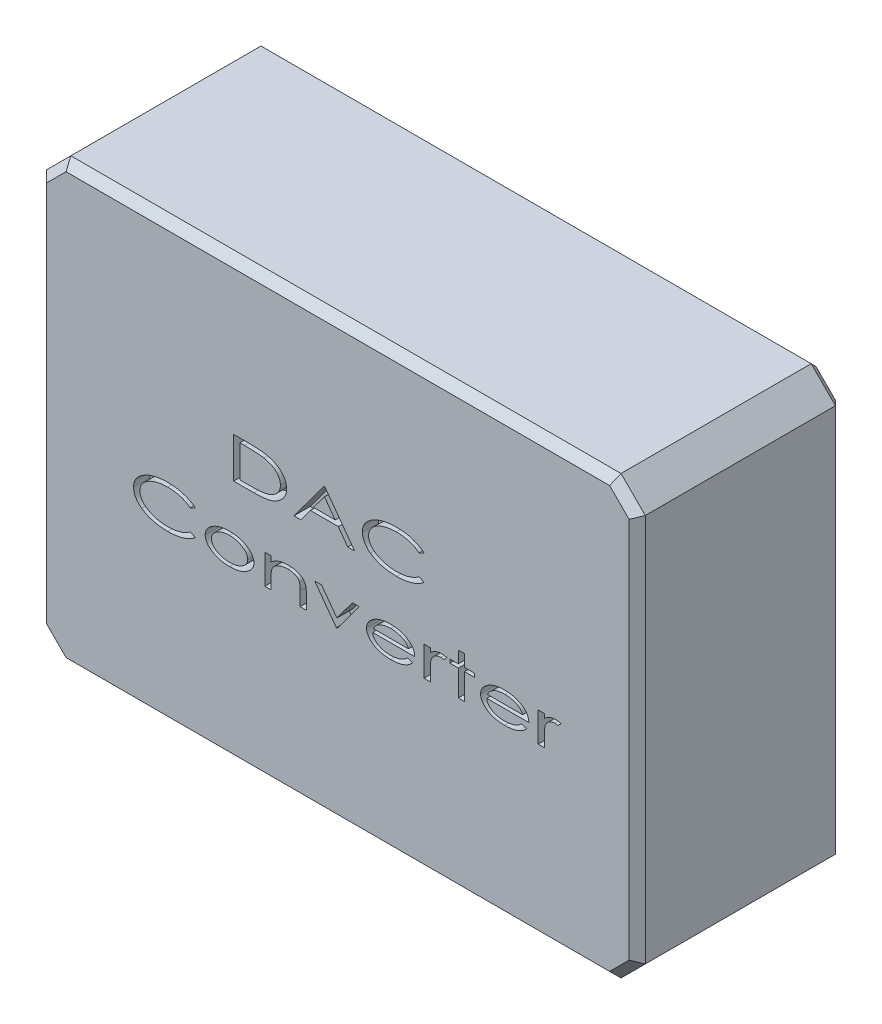
from build123d import *

# Parameters (mm, degrees)
SKETCH1_W           = 74
SKETCH1_H           = 54
BOSS_EXTRUDE1_DEPTH = 25.5
CHAMFER1_SIZE       = 3
CHAMFER2_SIZE       = 1
CUT_EXTRUDE1_DEPTH  = 2


with BuildPart() as part:
    # Sketch1 → Boss-Extrude1 (new body)
    with BuildSketch(Plane.XY):
        with Locations((37, 27)):
            Rectangle(SKETCH1_W, SKETCH1_H)
    extrude(amount=BOSS_EXTRUDE1_DEPTH)

    # Chamfer1
    chamfer1_edges = [part.edges().sort_by_distance(p)[0] for p in [
        (0, 0, 12.75),
        (74, 0, 12.75),
        (74, 54, 12.75),
        (0, 54, 12.75),
    ]]
    chamfer(chamfer1_edges, length=CHAMFER1_SIZE)

    # Chamfer2
    chamfer2_edges = [part.edges().sort_by_distance(p)[0] for p in [
        (37, 0, 0),
        (37, 0, 25.5),
        (0, 27, 0),
        (37, 54, 0),
        (74, 27, 0),
        (72.5, 52.5, 0),
        (1.5, 52.5, 0),
        (72.5, 1.5, 0),
        (1.5, 1.5, 0),
        (0, 27, 25.5),
        (74, 27, 25.5),
        (37, 54, 25.5),
        (72.5, 52.5, 25.5),
        (1.5, 52.5, 25.5),
        (72.5, 1.5, 25.5),
        (1.5, 1.5, 25.5),
    ]]
    chamfer(chamfer2_edges, length=CHAMFER2_SIZE)

    # Sketch2 → Cut-Extrude1 (cut)
    # profile 1 of 12: a face of its own
    with BuildSketch(Plane.XY.offset(25.5)):
        with BuildLine():
            Line((24.132229092, 30.246290498), (24.132229092, 35.246290498))
            Line((24.132229092, 35.246290498), (25.741804413, 35.246290498))
            add(Edge.make_bspline(
                [(25.741804413, 35.246290498), (25.813252591, 35.246037638), (25.953480479, 35.245541361), (26.160146309, 35.243430223), (26.359146227, 35.240710628), (26.550807659, 35.235865902), (26.734723373, 35.228185252), (26.911399764, 35.221865116), (27.080688584, 35.212795751), (27.242595935, 35.201653644), (27.396846083, 35.189616274), (27.543499531, 35.176984754), (27.68265843, 35.161545899), (27.814672286, 35.146113978), (27.939136462, 35.127719165), (28.056020394, 35.108813599), (28.165719199, 35.08921058), (28.235842569, 35.073581463), (28.269849285, 35.066002037)],
                knots=[0, 0, 0, 0, 1.350811625, 2.651172703, 3.907430285, 5.113461085, 6.275734084, 7.387548164, 8.455810569, 9.480731027, 10.45574647, 11.380964214, 12.263444926, 13.102745277, 13.893653518, 14.641847889, 15.341356621, 16, 16, 16, 16], degree=3))
            add(Edge.make_bspline(
                [(28.269849285, 35.066002037), (28.361612055, 35.044031795), (28.541505522, 35.000960919), (28.801101394, 34.919584583), (29.045067491, 34.826129591), (29.274698325, 34.722575705), (29.487603854, 34.604893752), (29.68678267, 34.477799552), (29.869021619, 34.337266197), (30.035716974, 34.186048471), (30.1847709, 34.025373824), (30.315138799, 33.856425376), (30.424837404, 33.679508337), (30.514441398, 33.494820546), (30.58560895, 33.302862117), (30.633688797, 33.102382486), (30.665219774, 32.89519184), (30.668852467, 32.754420581), (30.670690631, 32.683189537)],
                knots=[0, 0, 0, 0, 1.232647653, 2.416505715, 3.551581262, 4.644824175, 5.704995897, 6.727519334, 7.729227062, 8.708191178, 9.665184006, 10.589223822, 11.492348546, 12.380096058, 13.267532665, 14.161603306, 15.069760985, 16, 16, 16, 16], degree=3))
            add(Edge.make_bspline(
                [(30.670690631, 32.683189537), (30.669072367, 32.621360924), (30.665876926, 32.499273444), (30.642836623, 32.318994807), (30.602090055, 32.144891953), (30.547014365, 31.976231223), (30.47671382, 31.812515687), (30.388867458, 31.655474849), (30.286525786, 31.503248007), (30.167805934, 31.359077928), (30.038452376, 31.220998417), (29.897068799, 31.092690325), (29.747731402, 30.972488494), (29.587795706, 30.863017467), (29.41975963, 30.761324605), (29.240914177, 30.670634259), (29.053289592, 30.588456001), (28.854942486, 30.514331378), (28.641591476, 30.449861032), (28.409723228, 30.395194645), (28.15786586, 30.349715051), (27.885858211, 30.311920631), (27.593553423, 30.281911808), (27.280827939, 30.261696513), (26.948188416, 30.248113397), (26.719716945, 30.246909722), (26.602181015, 30.246290498)],
                knots=[0, 0, 0, 0, 0.839306076, 1.657303312, 2.462122006, 3.263359048, 4.063248836, 4.876813816, 5.702746589, 6.550091711, 7.409414165, 8.269214631, 9.139889763, 10.009915775, 10.898400356, 11.804514408, 12.730010374, 13.67800782, 14.677402505, 15.753690759, 16.910309298, 18.150648225, 19.481120666, 20.898477093, 22.404438092, 24, 24, 24, 24], degree=3))
            Line((26.602181015, 30.246290498), (24.132229092, 30.246290498))
        make_face()
        with BuildLine():
            Line((24.901459862, 30.759111011), (25.796892554, 30.759111011))
            add(Edge.make_bspline(
                [(25.796892554, 30.759111011), (25.862665749, 30.758905838), (25.99154468, 30.758503813), (26.180836621, 30.761384693), (26.362488202, 30.762395733), (26.536402736, 30.767366346), (26.702720969, 30.770335339), (26.861253487, 30.777345286), (27.012243658, 30.782291517), (27.155393361, 30.791260074), (27.290722882, 30.798275917), (27.418163788, 30.809097726), (27.538081593, 30.818707653), (27.650703491, 30.829317038), (27.755386239, 30.843018471), (27.852784788, 30.855130532), (27.941776108, 30.870645846), (27.99842594, 30.881252991), (28.025458259, 30.886314537)],
                knots=[0, 0, 0, 0, 1.412529061, 2.76777241, 4.065657525, 5.313601647, 6.504200063, 7.637907955, 8.721462284, 9.748403905, 10.718078786, 11.631512519, 12.494918726, 13.301844826, 14.060464003, 14.762191641, 15.409339276, 16, 16, 16, 16], degree=3))
            add(Edge.make_bspline(
                [(28.025458259, 30.886314537), (28.096741893, 30.902305635), (28.236184985, 30.933586983), (28.438205247, 30.991394636), (28.627512742, 31.059933717), (28.806014147, 31.13571661), (28.972368928, 31.221865447), (29.126879451, 31.317191652), (29.270341957, 31.420717345), (29.401318942, 31.533375248), (29.518490274, 31.65455543), (29.621360021, 31.781889692), (29.708460649, 31.915935375), (29.778770073, 32.057251762), (29.834249201, 32.204849354), (29.873253482, 32.359028327), (29.896808336, 32.51953405), (29.899891938, 32.628688975), (29.901459862, 32.684191139)],
                knots=[0, 0, 0, 0, 1.238897773, 2.423497863, 3.560871493, 4.651619713, 5.71024999, 6.734849785, 7.72817901, 8.707808056, 9.660892941, 10.583255092, 11.480095872, 12.366417479, 13.2551596, 14.1492253, 15.058933894, 16, 16, 16, 16], degree=3))
            add(Edge.make_bspline(
                [(29.901459862, 32.684191139), (29.900159951, 32.742726898), (29.897598588, 32.858066642), (29.870135733, 33.02712291), (29.828346021, 33.189729329), (29.768967852, 33.34616815), (29.69120635, 33.495504979), (29.597298107, 33.638813294), (29.48664458, 33.775449488), (29.358973946, 33.904273226), (29.216840374, 34.025610048), (29.060155805, 34.136394918), (28.890681129, 34.238002132), (28.708272512, 34.330591976), (28.511090071, 34.41078082), (28.301745381, 34.483408404), (28.078664961, 34.544217527), (27.924808016, 34.576662785), (27.8461714, 34.593245626)],
                knots=[0, 0, 0, 0, 0.918134727, 1.809106545, 2.68114836, 3.550366467, 4.429388806, 5.319018531, 6.235761044, 7.184514272, 8.162282374, 9.165727217, 10.193085636, 11.261892079, 12.37339418, 13.531942088, 14.738570272, 16, 16, 16, 16], degree=3))
            add(Edge.make_bspline(
                [(27.8461714, 34.593245626), (27.780824918, 34.604865387), (27.64093391, 34.629740483), (27.414818889, 34.656327529), (27.159341124, 34.680258515), (26.87414471, 34.700158657), (26.559542154, 34.714602324), (26.215622448, 34.725425222), (25.842329701, 34.732708721), (25.583554889, 34.733209992), (25.449336464, 34.733469985)],
                knots=[0, 0, 0, 0, 0.662548962, 1.418357028, 2.272139382, 3.224504634, 4.272396736, 5.416352635, 6.659942689, 8, 8, 8, 8], degree=3))
            Line((25.449336464, 34.733469985), (24.901459862, 34.733469985))
            Line((24.901459862, 34.733469985), (24.901459862, 30.759111011))
        make_face(mode=Mode.SUBTRACT)
    # profile 2 of 12: a face of its own
    with BuildSketch(Plane.XY.offset(25.5)):
        Polygon((35.414280374, 35.246290498), (39.068126528, 30.246290498), (38.220770759, 30.246290498), (37.049897362, 31.848854601), (33.610394156, 31.848854601), (32.418487105, 30.246290498), (31.568126528, 30.246290498), (35.286075246, 35.246290498), align=None)
        Polygon((35.344168195, 34.181586972), (33.991003131, 32.361675113), (36.675298003, 32.361675113), align=None, mode=Mode.SUBTRACT)
    # profile 3 of 12: a face of its own
    with BuildSketch(Plane.XY.offset(25.5)):
        with BuildLine():
            Line((47.657870118, 34.328822549), (47.037878131, 34.02834178))
            add(Edge.make_bspline(
                [(47.037878131, 34.02834178), (46.994516202, 34.061907953), (46.907208456, 34.129492284), (46.768595485, 34.222049178), (46.624231915, 34.309296905), (46.473817603, 34.390899069), (46.316043621, 34.464796063), (46.151867455, 34.532762317), (45.981418308, 34.594860881), (45.804956597, 34.650888569), (45.623236479, 34.700854278), (45.43678044, 34.743971887), (45.24589582, 34.77975309), (45.050556947, 34.81017468), (44.850340862, 34.83266637), (44.645964391, 34.849947748), (44.437156775, 34.860192728), (44.296503103, 34.86117726), (44.225378131, 34.861675113)],
                knots=[0, 0, 0, 0, 0.880526635, 1.772909963, 2.675099996, 3.58925896, 4.520002377, 5.472051922, 6.442410637, 7.432832085, 8.444965555, 9.468695536, 10.505696167, 11.563684201, 12.643250676, 13.740990368, 14.857676475, 16, 16, 16, 16], degree=3))
            add(Edge.make_bspline(
                [(44.225378131, 34.861675113), (44.147561458, 34.861112365), (43.993465822, 34.859997987), (43.764657433, 34.844815965), (43.540378958, 34.823471676), (43.320161448, 34.792212203), (43.104401163, 34.752002865), (42.892205839, 34.704496886), (42.685321249, 34.645810473), (42.483504005, 34.580527967), (42.289906494, 34.506292206), (42.105760705, 34.426779547), (41.933082561, 34.340732772), (41.77214453, 34.248007314), (41.621817735, 34.150402946), (41.482679389, 34.045924873), (41.355760337, 33.934478582), (41.239155236, 33.818785309), (41.135686986, 33.697686625), (41.046549388, 33.571937365), (40.969159113, 33.443279866), (40.907309619, 33.309817327), (40.858685557, 33.173040253), (40.824759908, 33.032375422), (40.802830671, 32.888206012), (40.800212297, 32.790439971), (40.798895759, 32.741282485)],
                knots=[0, 0, 0, 0, 1.262754237, 2.500555618, 3.720195221, 4.918731066, 6.109080816, 7.281648224, 8.446527735, 9.598059419, 10.723177259, 11.810389253, 12.852424427, 13.852532073, 14.82344101, 15.75980311, 16.673790199, 17.562729101, 18.42378157, 19.25527246, 20.061919981, 20.857073885, 21.638576783, 22.413988021, 23.202541484, 24, 24, 24, 24], degree=3))
            add(Edge.make_bspline(
                [(40.798895759, 32.741282485), (40.79979418, 32.704206008), (40.801586788, 32.630227773), (40.812012527, 32.520546931), (40.833000175, 32.413344682), (40.859731926, 32.308549969), (40.893639311, 32.20541198), (40.93706273, 32.105645824), (40.987530216, 32.008120702), (41.044487184, 31.91212811), (41.111219417, 31.819575208), (41.183954704, 31.727887897), (41.265850318, 31.640118997), (41.353694942, 31.553378901), (41.45094365, 31.470570223), (41.55416618, 31.387933425), (41.667508868, 31.310652989), (41.826391127, 31.206630711), (42.040402764, 31.089327337), (42.311680346, 30.965707812), (42.600106983, 30.862747583), (42.903653893, 30.777784931), (43.223595261, 30.711547608), (43.559260048, 30.66566039), (43.910980215, 30.635186008), (44.150858958, 30.632353505), (44.273455054, 30.630905883)],
                knots=[0, 0, 0, 0, 0.595923244, 1.189038255, 1.767783452, 2.349455757, 2.926307833, 3.510326049, 4.095821049, 4.690220778, 5.302064801, 5.927978715, 6.569674925, 7.229833822, 7.910706501, 8.621265817, 9.35353146, 10.113989948, 11.672641541, 13.269361911, 14.900284241, 16.588693416, 18.331184658, 20.146128044, 22.030381307, 24, 24, 24, 24], degree=3))
            add(Edge.make_bspline(
                [(44.273455054, 30.630905883), (44.341578828, 30.631372159), (44.476566818, 30.632296092), (44.67695856, 30.64304245), (44.873142124, 30.6583629), (45.065126401, 30.682037514), (45.253051944, 30.710378235), (45.436356904, 30.746824941), (45.615561796, 30.788762613), (45.790232304, 30.83786283), (45.961427212, 30.893000227), (46.128066928, 30.955090158), (46.290834846, 31.022822767), (46.448316967, 31.098893708), (46.602726312, 31.179152626), (46.751844136, 31.268081133), (46.897838133, 31.361735872), (46.991140799, 31.43002947), (47.037878131, 31.464239216)],
                knots=[0, 0, 0, 0, 1.112424984, 2.204282071, 3.276521881, 4.325467935, 5.362656928, 6.379583546, 7.376775322, 8.367656546, 9.341881084, 10.313171664, 11.271132726, 12.219831882, 13.168578043, 14.112108165, 15.05431399, 16, 16, 16, 16], degree=3))
            Line((47.037878131, 31.464239216), (47.657870118, 31.166763255))
            add(Edge.make_bspline(
                [(47.657870118, 31.166763255), (47.608204405, 31.125840797), (47.507968561, 31.043250678), (47.348516245, 30.927891885), (47.178989117, 30.821257402), (47.001026455, 30.720933599), (46.814946083, 30.626441106), (46.618822596, 30.540346629), (46.413766277, 30.461669029), (46.200383762, 30.389373872), (45.979507107, 30.325426992), (45.751485051, 30.270464139), (45.517235022, 30.223572481), (45.276754871, 30.184331382), (45.029824499, 30.154241392), (44.776528762, 30.133820898), (44.516664195, 30.120018219), (44.341248487, 30.118735111), (44.2524214, 30.11808537)],
                knots=[0, 0, 0, 0, 0.849255916, 1.713976879, 2.595423587, 3.491281704, 4.409649611, 5.348810785, 6.316938022, 7.307736318, 8.321627736, 9.35088771, 10.402645737, 11.474122285, 12.566197494, 13.684922241, 14.827689867, 16, 16, 16, 16], degree=3))
            add(Edge.make_bspline(
                [(44.2524214, 30.11808537), (44.168271476, 30.118460084), (44.001898941, 30.119200931), (43.756120124, 30.131168284), (43.516899705, 30.147512823), (43.284520737, 30.172141836), (43.058439599, 30.201060857), (42.839543897, 30.240073636), (42.627210088, 30.283499071), (42.421696684, 30.33460993), (42.222929813, 30.392892645), (42.030883993, 30.457441324), (41.846117545, 30.530249341), (41.667425536, 30.608178772), (41.495293555, 30.692831668), (41.33054836, 30.785759152), (41.171856146, 30.884203693), (41.071275687, 30.956518368), (41.021251528, 30.992484408)],
                knots=[0, 0, 0, 0, 1.186336878, 2.345502708, 3.468706994, 4.566640825, 5.639834598, 6.68151118, 7.700737239, 8.695159179, 9.666380797, 10.620580997, 11.550685232, 12.465511679, 13.36864887, 14.253831424, 15.131534932, 16, 16, 16, 16], degree=3))
            add(Edge.make_bspline(
                [(41.021251528, 30.992484408), (40.980848504, 31.023110335), (40.901188464, 31.0834935), (40.789338776, 31.180004124), (40.684536505, 31.278402297), (40.587579244, 31.379351089), (40.498086177, 31.482502279), (40.417119428, 31.58825027), (40.341629062, 31.695063803), (40.278021257, 31.806991934), (40.217408959, 31.918753308), (40.167831052, 32.034367219), (40.125604205, 32.15217501), (40.090302111, 32.272149151), (40.063690025, 32.394748111), (40.042877813, 32.519321546), (40.032310463, 32.64661253), (40.030550442, 32.732252284), (40.02966499, 32.775336972)],
                knots=[0, 0, 0, 0, 1.146819538, 2.261110184, 3.340546209, 4.398356617, 5.426625631, 6.428359998, 7.411088106, 8.382750846, 9.338993382, 10.286242842, 11.225264137, 12.169496871, 13.113366951, 14.062151247, 15.025083474, 16, 16, 16, 16], degree=3))
            add(Edge.make_bspline(
                [(40.02966499, 32.775336972), (40.030675746, 32.820780822), (40.032679753, 32.910881448), (40.047230989, 33.044400831), (40.06993265, 33.175422538), (40.103389922, 33.303479956), (40.145100794, 33.429326107), (40.198001979, 33.551247885), (40.257779559, 33.671830993), (40.329557117, 33.788084815), (40.408519672, 33.903173559), (40.498381381, 34.014556608), (40.597526239, 34.123079353), (40.704936828, 34.230407269), (40.823361028, 34.332541461), (40.950128761, 34.433411024), (41.086212673, 34.53127614), (41.231068131, 34.625920052), (41.382570037, 34.716822539), (41.540014575, 34.80195281), (41.70241269, 34.881164483), (41.869612822, 34.954029684), (42.041242367, 35.021483274), (42.217891494, 35.082236556), (42.399101427, 35.138646166), (42.585279071, 35.188438248), (42.77599646, 35.232695267), (42.971136785, 35.270517741), (43.171193553, 35.302882219), (43.376071849, 35.328198241), (43.585692061, 35.350111234), (43.800242573, 35.36314311), (44.019292219, 35.372902176), (44.16693973, 35.373961414), (44.241403772, 35.374495626)],
                knots=[0, 0, 0, 0, 0.799843037, 1.585833045, 2.361738468, 3.138622672, 3.913637222, 4.693073797, 5.476334359, 6.280677645, 7.095834575, 7.932013587, 8.797424212, 9.682625311, 10.60317637, 11.548588399, 12.533791369, 13.552605103, 14.593803807, 15.643082459, 16.702370302, 17.773542502, 18.8529383, 19.947697278, 21.06122653, 22.193199597, 23.339424849, 24.507042399, 25.691635611, 26.906118989, 28.140644724, 29.401060123, 30.689259522, 32, 32, 32, 32], degree=3))
            add(Edge.make_bspline(
                [(44.241403772, 35.374495626), (44.331229562, 35.373807907), (44.508975096, 35.372447061), (44.772242314, 35.359147925), (45.029104768, 35.337032129), (45.279307489, 35.306972768), (45.523145274, 35.269697594), (45.759797445, 35.220869797), (45.990088124, 35.165125682), (46.213385855, 35.1011953), (46.428233682, 35.029253275), (46.633907463, 34.950337335), (46.829158687, 34.863863889), (47.015427642, 34.772330607), (47.190480895, 34.67127189), (47.357435898, 34.565998561), (47.512901685, 34.451561211), (47.609903512, 34.369433853), (47.657870118, 34.328822549)],
                knots=[0, 0, 0, 0, 1.181932171, 2.338784486, 3.467618338, 4.57382659, 5.654376487, 6.712426657, 7.752408671, 8.771667035, 9.767787455, 10.732977689, 11.669289735, 12.577006288, 13.462507076, 14.327800395, 15.173111039, 16, 16, 16, 16], degree=3))
        make_face()
    # profile 4 of 12: a face of its own
    with BuildSketch(Plane.XY.offset(25.5)):
        with BuildLine():
            Line((19.388639349, 24.995489216), (18.768647362, 24.695008447))
            add(Edge.make_bspline(
                [(18.768647362, 24.695008447), (18.725285433, 24.72857462), (18.637977687, 24.79615895), (18.499364716, 24.888715845), (18.355001146, 24.975963572), (18.204586834, 25.057565736), (18.046812851, 25.13146273), (17.882636686, 25.199428984), (17.712187539, 25.261527547), (17.535725828, 25.317555236), (17.35400571, 25.367520945), (17.16754967, 25.410638553), (16.976665051, 25.446419757), (16.781326178, 25.476841346), (16.581110093, 25.499333037), (16.376733621, 25.516614415), (16.167926006, 25.526859394), (16.027272334, 25.527843927), (15.956147362, 25.52834178)],
                knots=[0, 0, 0, 0, 0.880526635, 1.772909963, 2.675099996, 3.58925896, 4.520002377, 5.472051922, 6.442410637, 7.432832085, 8.444965555, 9.468695536, 10.505696167, 11.563684201, 12.643250676, 13.740990368, 14.857676475, 16, 16, 16, 16], degree=3))
            add(Edge.make_bspline(
                [(15.956147362, 25.52834178), (15.878330689, 25.527779031), (15.724235053, 25.526664654), (15.495426664, 25.511482631), (15.271148189, 25.490138342), (15.050930678, 25.45887887), (14.835170394, 25.418669531), (14.62297507, 25.371163553), (14.416090479, 25.31247714), (14.214273236, 25.247194633), (14.020675725, 25.172958872), (13.836529935, 25.093446214), (13.663851792, 25.007399439), (13.502913761, 24.914673981), (13.352586966, 24.817069612), (13.21344862, 24.71259154), (13.086529568, 24.601145249), (12.969924467, 24.485451975), (12.866456217, 24.364353292), (12.777318619, 24.238604032), (12.699928343, 24.109946532), (12.638078849, 23.976483994), (12.589454787, 23.83970692), (12.555529138, 23.699042088), (12.533599902, 23.554872678), (12.530981528, 23.457106638), (12.52966499, 23.407949152)],
                knots=[0, 0, 0, 0, 1.262754237, 2.500555618, 3.720195221, 4.918731066, 6.109080816, 7.281648224, 8.446527735, 9.598059419, 10.723177259, 11.810389253, 12.852424427, 13.852532073, 14.82344101, 15.75980311, 16.673790199, 17.562729101, 18.42378157, 19.25527246, 20.061919981, 20.857073885, 21.638576783, 22.413988021, 23.202541484, 24, 24, 24, 24], degree=3))
            add(Edge.make_bspline(
                [(12.52966499, 23.407949152), (12.530563411, 23.370872675), (12.532356019, 23.296894439), (12.542781758, 23.187213598), (12.563769406, 23.080011348), (12.590501157, 22.975216636), (12.624408541, 22.872078647), (12.667831961, 22.77231249), (12.718299446, 22.674787369), (12.775256415, 22.578794777), (12.841988648, 22.486241875), (12.914723935, 22.394554564), (12.996619549, 22.306785664), (13.084464173, 22.220045567), (13.181712881, 22.13723689), (13.284935411, 22.054600091), (13.398278099, 21.977319656), (13.557160358, 21.873297378), (13.771171995, 21.755994003), (14.042449577, 21.632374479), (14.330876213, 21.52941425), (14.634423124, 21.444451598), (14.954364492, 21.378214275), (15.290029279, 21.332327057), (15.641749446, 21.301852675), (15.881628189, 21.299020172), (16.004224285, 21.297572549)],
                knots=[0, 0, 0, 0, 0.595923244, 1.189038255, 1.767783452, 2.349455757, 2.926307833, 3.510326049, 4.095821049, 4.690220778, 5.302064801, 5.927978715, 6.569674925, 7.229833822, 7.910706501, 8.621265817, 9.35353146, 10.113989948, 11.672641541, 13.269361911, 14.900284241, 16.588693416, 18.331184658, 20.146128044, 22.030381307, 24, 24, 24, 24], degree=3))
            add(Edge.make_bspline(
                [(16.004224285, 21.297572549), (16.072348058, 21.298038826), (16.207336049, 21.298962758), (16.40772779, 21.309709116), (16.603911355, 21.325029567), (16.795895631, 21.348704181), (16.983821175, 21.377044902), (17.167126135, 21.413491608), (17.346331027, 21.45542928), (17.521001535, 21.504529497), (17.692196443, 21.559666893), (17.858836159, 21.621756825), (18.021604077, 21.689489434), (18.179086198, 21.765560374), (18.333495543, 21.845819293), (18.482613367, 21.934747799), (18.628607364, 22.028402539), (18.72191003, 22.096696137), (18.768647362, 22.130905883)],
                knots=[0, 0, 0, 0, 1.112424984, 2.204282071, 3.276521881, 4.325467935, 5.362656928, 6.379583546, 7.376775322, 8.367656546, 9.341881084, 10.313171664, 11.271132726, 12.219831882, 13.168578043, 14.112108165, 15.05431399, 16, 16, 16, 16], degree=3))
            Line((18.768647362, 22.130905883), (19.388639349, 21.833429921))
            add(Edge.make_bspline(
                [(19.388639349, 21.833429921), (19.338973636, 21.792507463), (19.238737792, 21.709917345), (19.079285475, 21.594558552), (18.909758347, 21.487924069), (18.731795686, 21.387600266), (18.545715314, 21.293107773), (18.349591827, 21.207013296), (18.144535508, 21.128335695), (17.931152993, 21.056040539), (17.710276338, 20.992093659), (17.482254282, 20.937130806), (17.248004253, 20.890239147), (17.007524102, 20.850998048), (16.76059373, 20.820908059), (16.507297993, 20.800487565), (16.247433426, 20.786684885), (16.072017717, 20.785401777), (15.983190631, 20.784752037)],
                knots=[0, 0, 0, 0, 0.849255916, 1.713976879, 2.595423587, 3.491281704, 4.409649611, 5.348810785, 6.316938022, 7.307736318, 8.321627736, 9.35088771, 10.402645737, 11.474122285, 12.566197494, 13.684922241, 14.827689867, 16, 16, 16, 16], degree=3))
            add(Edge.make_bspline(
                [(15.983190631, 20.784752037), (15.899040707, 20.785126751), (15.732668171, 20.785867598), (15.486889354, 20.797834951), (15.247668936, 20.81417949), (15.015289968, 20.838808503), (14.78920883, 20.867727524), (14.570313128, 20.906740303), (14.357979319, 20.950165738), (14.152465914, 21.001276597), (13.953699044, 21.059559311), (13.761653223, 21.124107991), (13.576886776, 21.196916008), (13.398194766, 21.274845439), (13.226062785, 21.359498335), (13.061317591, 21.452425819), (12.902625377, 21.55087036), (12.802044918, 21.623185035), (12.752020759, 21.659151075)],
                knots=[0, 0, 0, 0, 1.186336878, 2.345502708, 3.468706994, 4.566640825, 5.639834598, 6.68151118, 7.700737239, 8.695159179, 9.666380797, 10.620580997, 11.550685232, 12.465511679, 13.36864887, 14.253831424, 15.131534932, 16, 16, 16, 16], degree=3))
            add(Edge.make_bspline(
                [(12.752020759, 21.659151075), (12.711617735, 21.689777001), (12.631957695, 21.750160167), (12.520108007, 21.84667079), (12.415305735, 21.945068963), (12.318348475, 22.046017756), (12.228855408, 22.149168946), (12.147888658, 22.254916936), (12.072398293, 22.36173047), (12.008790487, 22.473658601), (11.94817819, 22.585419975), (11.898600283, 22.701033886), (11.856373436, 22.818841676), (11.821071342, 22.938815817), (11.794459255, 23.061414777), (11.773647044, 23.185988213), (11.763079693, 23.313279197), (11.761319673, 23.39891895), (11.76043422, 23.442003639)],
                knots=[0, 0, 0, 0, 1.146819538, 2.261110184, 3.340546209, 4.398356617, 5.426625631, 6.428359998, 7.411088106, 8.382750846, 9.338993382, 10.286242842, 11.225264137, 12.169496871, 13.113366951, 14.062151247, 15.025083474, 16, 16, 16, 16], degree=3))
            add(Edge.make_bspline(
                [(11.76043422, 23.442003639), (11.761444977, 23.487447489), (11.763448984, 23.577548114), (11.77800022, 23.711067498), (11.80070188, 23.842089204), (11.834159153, 23.970146623), (11.875870025, 24.095992773), (11.928771209, 24.217914552), (11.98854879, 24.33849766), (12.060326348, 24.454751481), (12.139288902, 24.569840226), (12.229150612, 24.681223274), (12.32829547, 24.78974602), (12.435706059, 24.897073936), (12.554130259, 24.999208128), (12.680897992, 25.100077691), (12.816981904, 25.197942807), (12.961837361, 25.292586718), (13.113339267, 25.383489206), (13.270783806, 25.468619476), (13.433181921, 25.54783115), (13.600382052, 25.620696351), (13.772011598, 25.68814994), (13.948660725, 25.748903222), (14.129870658, 25.805312832), (14.316048301, 25.855104914), (14.506765691, 25.899361934), (14.701906016, 25.937184407), (14.901962783, 25.969548886), (15.10684108, 25.994864907), (15.316461292, 26.016777901), (15.531011804, 26.029809776), (15.75006145, 26.039568843), (15.89770896, 26.040628081), (15.972173003, 26.041162293)],
                knots=[0, 0, 0, 0, 0.799843037, 1.585833045, 2.361738468, 3.138622672, 3.913637222, 4.693073797, 5.476334359, 6.280677645, 7.095834575, 7.932013587, 8.797424212, 9.682625311, 10.60317637, 11.548588399, 12.533791369, 13.552605103, 14.593803807, 15.643082459, 16.702370302, 17.773542502, 18.8529383, 19.947697278, 21.06122653, 22.193199597, 23.339424849, 24.507042399, 25.691635611, 26.906118989, 28.140644724, 29.401060123, 30.689259522, 32, 32, 32, 32], degree=3))
            add(Edge.make_bspline(
                [(15.972173003, 26.041162293), (16.061998793, 26.040474574), (16.239744326, 26.039113728), (16.503011545, 26.025814592), (16.759873999, 26.003698795), (17.01007672, 25.973639434), (17.253914505, 25.93636426), (17.490566675, 25.887536463), (17.720857355, 25.831792349), (17.944155086, 25.767861967), (18.159002913, 25.695919942), (18.364676694, 25.617004002), (18.559927918, 25.530530556), (18.746196873, 25.438997274), (18.921250126, 25.337938557), (19.088205129, 25.232665228), (19.243670915, 25.118227878), (19.340672742, 25.03610052), (19.388639349, 24.995489216)],
                knots=[0, 0, 0, 0, 1.181932171, 2.338784486, 3.467618338, 4.57382659, 5.654376487, 6.712426657, 7.752408671, 8.771667035, 9.767787455, 10.732977689, 11.669289735, 12.577006288, 13.462507076, 14.327800395, 15.173111039, 16, 16, 16, 16], degree=3))
        make_face()
    # profile 5 of 12: a face of its own
    with BuildSketch(Plane.XY.offset(25.5)):
        with BuildLine():
            add(Edge.make_bspline(
                [(23.622413387, 24.630905883), (23.731325058, 24.629427801), (23.944880636, 24.626529558), (24.257654265, 24.596378011), (24.556120425, 24.549684463), (24.840758464, 24.485301372), (25.110779873, 24.399639451), (25.367148513, 24.29637434), (25.610097531, 24.17519248), (25.760350884, 24.077465395), (25.834953451, 24.028942742)],
                knots=[0, 0, 0, 0, 1.122554436, 2.201120976, 3.236148311, 4.235628563, 5.206681061, 6.15331682, 7.083099955, 8, 8, 8, 8], degree=3))
            add(Edge.make_bspline(
                [(25.834953451, 24.028942742), (25.898430772, 23.983509533), (26.021150064, 23.895674521), (26.182462536, 23.746725428), (26.321859726, 23.594555918), (26.435225862, 23.4341889), (26.52323717, 23.267108072), (26.585825303, 23.093564511), (26.625979849, 22.913993659), (26.63013701, 22.791505897), (26.632229092, 22.729864216)],
                knots=[0, 0, 0, 0, 1.17798337, 2.277369033, 3.30925855, 4.290002483, 5.235095009, 6.15233236, 7.070165576, 8, 8, 8, 8], degree=3))
            add(Edge.make_bspline(
                [(26.632229092, 22.729864216), (26.629882821, 22.667864399), (26.625216105, 22.544547213), (26.582689286, 22.363621273), (26.517318517, 22.188086054), (26.424162415, 22.018760504), (26.302758484, 21.85684837), (26.156978737, 21.700055696), (25.983591673, 21.550980974), (25.787898615, 21.407754139), (25.57109689, 21.276296946), (25.336674427, 21.162499826), (25.08812656, 21.064467052), (24.82382751, 20.986123709), (24.544776033, 20.923799462), (24.250540744, 20.88030831), (23.941405613, 20.854005459), (23.730305668, 20.850596768), (23.622413387, 20.848854601)],
                knots=[0, 0, 0, 0, 0.761473822, 1.514565906, 2.273378309, 3.059836524, 3.88186777, 4.756357965, 5.687621411, 6.689548882, 7.735945976, 8.801002759, 9.890573613, 11.018103609, 12.187600359, 13.404133069, 14.673263485, 16, 16, 16, 16], degree=3))
            add(Edge.make_bspline(
                [(23.622413387, 20.848854601), (23.514188028, 20.850607477), (23.30209022, 20.854042728), (22.991616825, 20.880261429), (22.696360345, 20.923684532), (22.416685174, 20.98623667), (22.151473668, 21.064710122), (21.901618305, 21.162023301), (21.666745074, 21.27635464), (21.449892686, 21.407723193), (21.254290375, 21.551044745), (21.080790262, 21.699703891), (20.936100242, 21.857195548), (20.814610424, 22.018719362), (20.721509837, 22.188096447), (20.656124959, 22.363618568), (20.613601789, 22.544547896), (20.608934584, 22.667864628), (20.606588067, 22.729864216)],
                knots=[0, 0, 0, 0, 1.328753202, 2.604062895, 3.82274145, 4.990403624, 6.120091699, 7.215589079, 8.27897512, 9.323730745, 10.324086503, 11.253889088, 12.124221669, 12.944963405, 13.730187912, 14.487809975, 15.239720693, 16, 16, 16, 16], degree=3))
            add(Edge.make_bspline(
                [(20.606588067, 22.729864216), (20.608698906, 22.791170823), (20.612904679, 22.913322036), (20.653017657, 23.092552833), (20.715380951, 23.265865387), (20.80355255, 23.43228285), (20.917637385, 23.591650185), (21.05562122, 23.744774109), (21.218093048, 23.892548241), (21.340469335, 23.980418604), (21.403863708, 24.025937934)],
                knots=[0, 0, 0, 0, 0.926337426, 1.845694065, 2.764453848, 3.706644058, 4.684890689, 5.722250452, 6.82006141, 8, 8, 8, 8], degree=3))
            add(Edge.make_bspline(
                [(21.403863708, 24.025937934), (21.478417103, 24.074879717), (21.628421111, 24.173352275), (21.872173664, 24.294301971), (22.128523873, 24.398777759), (22.399531348, 24.484076025), (22.684864498, 24.550143279), (22.98487849, 24.596179628), (23.298937579, 24.626572482), (23.51316506, 24.629442352), (23.622413387, 24.630905883)],
                knots=[0, 0, 0, 0, 0.915966615, 1.842956474, 2.791217493, 3.759352732, 4.75994653, 5.798644137, 6.877387506, 8, 8, 8, 8], degree=3))
        make_face()
        with BuildLine():
            add(Edge.make_bspline(
                [(23.619408579, 24.182187934), (23.543907589, 24.180828438), (23.395639929, 24.178158681), (23.177192489, 24.157486275), (22.967006545, 24.124896445), (22.76438581, 24.078786546), (22.570173449, 24.018844321), (22.38389249, 23.945070332), (22.205110324, 23.859527071), (22.037599051, 23.759628738), (21.883196165, 23.652402798), (21.748143392, 23.537063062), (21.633960313, 23.416181848), (21.538835927, 23.290385749), (21.466513002, 23.157044827), (21.413664703, 23.018797781), (21.381177679, 22.874595108), (21.377617212, 22.776438094), (21.375818836, 22.726859408)],
                knots=[0, 0, 0, 0, 1.232162217, 2.419700828, 3.57812495, 4.701778772, 5.808375782, 6.892169006, 7.969448776, 9.039551257, 10.072157485, 11.034425934, 11.932656964, 12.781684744, 13.601058971, 14.399600651, 15.191645156, 16, 16, 16, 16], degree=3))
            add(Edge.make_bspline(
                [(21.375818836, 22.726859408), (21.376851887, 22.694757787), (21.37891687, 22.6305893), (21.393441178, 22.535333072), (21.416460952, 22.441317927), (21.449543329, 22.348923523), (21.493323692, 22.25900729), (21.544269905, 22.169975353), (21.606199938, 22.083574991), (21.6770628, 21.999097982), (21.755390506, 21.917403597), (21.841432628, 21.841231176), (21.932976625, 21.76842605), (22.031589297, 21.700616887), (22.137569884, 21.638804092), (22.248845922, 21.58019724), (22.367347133, 21.527231196), (22.535243794, 21.463108091), (22.755907791, 21.395985116), (23.032906083, 21.339619906), (23.321956215, 21.303062945), (23.519135188, 21.299423402), (23.619408579, 21.297572549)],
                knots=[0, 0, 0, 0, 0.657554461, 1.314396975, 1.969706182, 2.638268866, 3.320547795, 4.016272605, 4.737489756, 5.495061423, 6.273919816, 7.053858789, 7.847593591, 8.669136316, 9.503226719, 10.359898586, 11.24472718, 12.160631858, 14.041005181, 15.962057428, 17.946544742, 20, 20, 20, 20], degree=3))
            add(Edge.make_bspline(
                [(23.619408579, 21.297572549), (23.719682991, 21.299420153), (23.91686397, 21.303053305), (24.205899598, 21.339656465), (24.482637243, 21.395790385), (24.70284565, 21.463288462), (24.870490076, 21.527184456), (24.989169351, 21.580462149), (25.101018291, 21.638578643), (25.20713679, 21.700282293), (25.305016305, 21.769085942), (25.39734921, 21.840847708), (25.483383902, 21.917459105), (25.561765479, 21.999083544), (25.632614429, 22.083578615), (25.694547958, 22.169974439), (25.745493285, 22.259007526), (25.789273877, 22.348923461), (25.822356195, 22.441317943), (25.845375984, 22.535333068), (25.859900288, 22.630589301), (25.861965272, 22.694757787), (25.862998323, 22.726859408)],
                knots=[0, 0, 0, 0, 2.053530046, 4.038089638, 5.959211851, 7.833110284, 8.74904832, 9.63390914, 10.496680762, 11.330801543, 12.146744858, 12.945884303, 13.725851683, 14.504738442, 15.2623377, 15.983581119, 16.679331268, 17.361635046, 18.030222079, 18.685555154, 19.34242159, 20, 20, 20, 20], degree=3))
            add(Edge.make_bspline(
                [(25.862998323, 22.726859408), (25.861206086, 22.776441542), (25.857657775, 22.87460538), (25.825080748, 23.018757522), (25.772521551, 23.157349669), (25.698742678, 23.290061488), (25.603942492, 23.416536258), (25.488573243, 23.537052678), (25.352696526, 23.652072025), (25.198114432, 23.760026459), (25.030031331, 23.858895284), (24.851515937, 23.945658397), (24.66512097, 24.018348776), (24.47117418, 24.079033249), (24.269105029, 24.12473615), (24.059633694, 24.157518259), (23.842175399, 24.178151489), (23.6945752, 24.180825945), (23.619408579, 24.182187934)],
                knots=[0, 0, 0, 0, 0.808662693, 1.601008837, 2.399854629, 3.222165295, 4.071516414, 4.973835552, 5.940613898, 6.973613378, 8.048818663, 9.121602701, 10.210881504, 11.312693012, 12.436774761, 13.590254942, 14.772817416, 16, 16, 16, 16], degree=3))
        make_face(mode=Mode.SUBTRACT)
    # profile 6 of 12: a face of its own
    with BuildSketch(Plane.XY.offset(25.5)):
        with BuildLine():
            Line((27.978382938, 24.566803319), (28.747613708, 24.566803319))
            Line((28.747613708, 24.566803319), (28.747613708, 23.907748831))
            add(Edge.make_bspline(
                [(28.747613708, 23.907748831), (28.823954153, 23.96805485), (28.975518226, 24.087784645), (29.221356264, 24.239157321), (29.47936277, 24.363856456), (29.749464398, 24.463622743), (30.031897195, 24.537707109), (30.325751002, 24.592200511), (30.631904667, 24.624528433), (30.840218574, 24.628756309), (30.946131336, 24.630905883)],
                knots=[0, 0, 0, 0, 0.987153343, 1.959865209, 2.924123013, 3.892620039, 4.878527013, 5.885161353, 6.924755403, 8, 8, 8, 8], degree=3))
            add(Edge.make_bspline(
                [(30.946131336, 24.630905883), (31.000235095, 24.630436484), (31.106869992, 24.629511331), (31.264243885, 24.618972863), (31.416943324, 24.603019033), (31.565131806, 24.581376066), (31.708891759, 24.55222329), (31.847884615, 24.516132323), (31.982284445, 24.474071931), (32.111508284, 24.426298152), (32.233932433, 24.37216744), (32.349561679, 24.314727209), (32.455861957, 24.251070991), (32.55469148, 24.184126691), (32.644734986, 24.112080588), (32.726668229, 24.035572513), (32.799667913, 23.954185595), (32.866159466, 23.86822641), (32.924589469, 23.773375842), (32.973073776, 23.666821382), (33.013793172, 23.548189537), (33.049356831, 23.418277932), (33.074267234, 23.27533467), (33.093582993, 23.120605291), (33.104136881, 22.953701033), (33.10575433, 22.838384378), (33.106588067, 22.778942742)],
                knots=[0, 0, 0, 0, 1.190541746, 2.346478272, 3.469508842, 4.568926754, 5.641045747, 6.696083243, 7.727914345, 8.739266639, 9.726304024, 10.67268339, 11.578725476, 12.451007425, 13.297882971, 14.114014097, 14.91522359, 15.7014686, 16.502947589, 17.361001508, 18.271946375, 19.261169287, 20.321897247, 21.462032424, 22.691767933, 24, 24, 24, 24], degree=3))
            Line((33.106588067, 22.778942742), (33.106588067, 20.912957165))
            Line((33.106588067, 20.912957165), (32.337357297, 20.912957165))
            Line((32.337357297, 20.912957165), (32.337357297, 22.631707165))
            add(Edge.make_bspline(
                [(32.337357297, 22.631707165), (32.337196678, 22.681456145), (32.336889419, 22.776623614), (32.333726109, 22.912849274), (32.329428659, 23.036478372), (32.320710245, 23.146910263), (32.312919104, 23.244671464), (32.299909072, 23.328945994), (32.288713304, 23.401057909), (32.275990972, 23.443765277), (32.270249926, 23.463037293)],
                knots=[0, 0, 0, 0, 1.427532579, 2.730802956, 3.910182581, 4.976380879, 5.909684789, 6.722620548, 7.423573067, 8, 8, 8, 8], degree=3))
            add(Edge.make_bspline(
                [(32.270249926, 23.463037293), (32.260954163, 23.492359666), (32.24257751, 23.550326619), (32.202707494, 23.631686827), (32.154983367, 23.707826825), (32.099398726, 23.778863872), (32.03412938, 23.84321571), (31.9618669, 23.902983339), (31.879815617, 23.955897802), (31.790010692, 24.003783987), (31.692259432, 24.045537176), (31.587751579, 24.083014006), (31.475818142, 24.113579289), (31.356690331, 24.138529551), (31.231031922, 24.158520336), (31.09797409, 24.172483436), (30.957911318, 24.180279085), (30.862006239, 24.181541685), (30.812918195, 24.182187934)],
                knots=[0, 0, 0, 0, 0.84440541, 1.669292229, 2.481424419, 3.311145147, 4.141626552, 4.995747207, 5.88393487, 6.819847078, 7.78973118, 8.802587186, 9.868894124, 10.975649175, 12.146249881, 13.364223531, 14.650904489, 16, 16, 16, 16], degree=3))
            add(Edge.make_bspline(
                [(30.812918195, 24.182187934), (30.756137615, 24.181495269), (30.643758099, 24.180124354), (30.477521874, 24.166890341), (30.316137547, 24.144555474), (30.158932758, 24.1152895), (30.007001226, 24.074015423), (29.858050536, 24.028237167), (29.714853264, 23.969964337), (29.576452491, 23.906289593), (29.447509151, 23.833841505), (29.327311429, 23.759576093), (29.219980251, 23.67881991), (29.12333403, 23.595006974), (29.038613506, 23.506626865), (28.96591113, 23.413656518), (28.904130739, 23.316937139), (28.872418223, 23.248412783), (28.856788387, 23.214639857)],
                knots=[0, 0, 0, 0, 1.186746739, 2.348796475, 3.48284601, 4.591508102, 5.688422099, 6.772135795, 7.846483317, 8.917379841, 9.954496972, 10.936172447, 11.868558748, 12.758803468, 13.607827135, 14.423138405, 15.222827736, 16, 16, 16, 16], degree=3))
            add(Edge.make_bspline(
                [(28.856788387, 23.214639857), (28.84762633, 23.190085951), (28.827868516, 23.137135887), (28.806918852, 23.048656365), (28.789379745, 22.946527441), (28.773167671, 22.831017264), (28.761458314, 22.701329319), (28.753920139, 22.557995641), (28.748841387, 22.400706479), (28.748034357, 22.291166628), (28.747613708, 22.234070947)],
                knots=[0, 0, 0, 0, 0.634004878, 1.367220277, 2.196489387, 3.143020379, 4.190257694, 5.347965672, 6.617674725, 8, 8, 8, 8], degree=3))
            Line((28.747613708, 22.234070947), (28.747613708, 20.912957165))
            Line((28.747613708, 20.912957165), (27.978382938, 20.912957165))
            Line((27.978382938, 20.912957165), (27.978382938, 24.566803319))
        make_face()
    # profile 7 of 12: a face of its own
    with BuildSketch(Plane.XY.offset(25.5)):
        Polygon((34.132229092, 24.566803319), (34.980586464, 24.566803319), (36.888639349, 21.976659088), (38.796692233, 24.566803319), (39.645049605, 24.566803319), (36.952741913, 20.912957165), (36.824536785, 20.912957165), align=None)
    # profile 8 of 12: a face of its own
    with BuildSketch(Plane.XY.offset(25.5)):
        with BuildLine():
            Line((45.616604092, 22.066803319), (46.247613708, 21.857468383))
            add(Edge.make_bspline(
                [(46.247613708, 21.857468383), (46.195926895, 21.800642515), (46.09326869, 21.687777334), (45.921172094, 21.538154553), (45.739901927, 21.402120273), (45.544078086, 21.286639734), (45.337370263, 21.184795882), (45.118130297, 21.09694098), (44.886669592, 21.020869908), (44.64222057, 20.957481615), (44.383248246, 20.908418145), (44.108615886, 20.874005223), (43.817732995, 20.85260745), (43.618445229, 20.850126777), (43.516243515, 20.848854601)],
                knots=[0, 0, 0, 0, 0.919473238, 1.826219619, 2.726921458, 3.630947046, 4.544950114, 5.485195359, 6.457794577, 7.461801204, 8.50818498, 9.612948656, 10.775836851, 12, 12, 12, 12], degree=3))
            add(Edge.make_bspline(
                [(43.516243515, 20.848854601), (43.403006965, 20.850501023), (43.182205697, 20.853711401), (42.860703238, 20.881025119), (42.557822011, 20.925669378), (42.274062772, 20.988179317), (42.009243738, 21.069163301), (41.763532387, 21.168626286), (41.536137894, 21.285236473), (41.330721555, 21.420683498), (41.147219985, 21.566433222), (40.985772401, 21.717414002), (40.849205381, 21.874122317), (40.738145564, 22.036269975), (40.650853556, 22.202566851), (40.587687501, 22.373680183), (40.549195126, 22.550194895), (40.544724261, 22.66991506), (40.542485503, 22.729864216)],
                knots=[0, 0, 0, 0, 1.400107258, 2.730085447, 3.986621822, 5.183632809, 6.319800903, 7.406955068, 8.45765522, 9.47452044, 10.444288719, 11.352602237, 12.204356904, 13.009402314, 13.777609587, 14.520824856, 15.2593119, 16, 16, 16, 16], degree=3))
            add(Edge.make_bspline(
                [(40.542485503, 22.729864216), (40.544764804, 22.786085618), (40.549303702, 22.898042356), (40.580972071, 23.063617763), (40.634889095, 23.224280848), (40.709793192, 23.379980008), (40.804548426, 23.531692298), (40.922454129, 23.676916812), (41.059681066, 23.81908817), (41.16391886, 23.905396766), (41.217565631, 23.949816139)],
                knots=[0, 0, 0, 0, 0.933775436, 1.859477829, 2.789043516, 3.741669851, 4.723476556, 5.753374381, 6.843757109, 8, 8, 8, 8], degree=3))
            add(Edge.make_bspline(
                [(41.217565631, 23.949816139), (41.291033695, 24.00434467), (41.438899796, 24.114091963), (41.681014095, 24.253766095), (41.942193625, 24.369279041), (42.22006177, 24.466013955), (42.516626804, 24.539321124), (42.83045285, 24.593825906), (43.163075026, 24.62430628), (43.390649752, 24.628670322), (43.507229092, 24.630905883)],
                knots=[0, 0, 0, 0, 0.901440005, 1.814290605, 2.748351024, 3.71326268, 4.711108295, 5.756527669, 6.850740019, 8, 8, 8, 8], degree=3))
            add(Edge.make_bspline(
                [(43.507229092, 24.630905883), (43.627175616, 24.628993097), (43.861565847, 24.62525528), (44.203952725, 24.590196342), (44.527875316, 24.535062206), (44.833298215, 24.456996989), (45.120186354, 24.355927773), (45.388238057, 24.23117969), (45.639086591, 24.085804545), (45.790697378, 23.969516186), (45.866003131, 23.911755242)],
                knots=[0, 0, 0, 0, 1.144252519, 2.236009881, 3.280386587, 4.277166952, 5.240460197, 6.17833642, 7.095171598, 8, 8, 8, 8], degree=3))
            add(Edge.make_bspline(
                [(45.866003131, 23.911755242), (45.915941468, 23.868948317), (46.013617287, 23.785221032), (46.143014035, 23.646113203), (46.251454277, 23.498106175), (46.341675858, 23.342852329), (46.412305284, 23.179443602), (46.463274961, 23.007997756), (46.496596488, 22.828617295), (46.501523394, 22.705972653), (46.504023964, 22.643726396)],
                knots=[0, 0, 0, 0, 1.074051925, 2.10076879, 3.095769424, 4.066000151, 5.028641635, 5.99678472, 6.983301262, 8, 8, 8, 8], degree=3))
            Line((46.504023964, 22.643726396), (41.311716272, 22.643726396))
            add(Edge.make_bspline(
                [(41.311716272, 22.643726396), (41.315008674, 22.595466285), (41.321530029, 22.499876099), (41.355520269, 22.360488427), (41.40835993, 22.228538851), (41.477863058, 22.102687288), (41.567565568, 21.984743067), (41.675347269, 21.873380652), (41.801896374, 21.769205602), (41.944140462, 21.671628728), (42.100912758, 21.584671963), (42.267404401, 21.507108848), (42.443321787, 21.442062364), (42.628151308, 21.389028068), (42.82196239, 21.347958988), (43.024798453, 21.319581513), (43.236443222, 21.300775438), (43.38065158, 21.298653796), (43.454144156, 21.297572549)],
                knots=[0, 0, 0, 0, 0.832589835, 1.64913458, 2.460226409, 3.276852265, 4.119347054, 5.006585459, 5.942345896, 6.939976256, 7.975717634, 9.028772243, 10.103076094, 11.204999952, 12.340449766, 13.514825786, 14.733486344, 16, 16, 16, 16], degree=3))
            add(Edge.make_bspline(
                [(43.454144156, 21.297572549), (43.525955694, 21.298446417), (43.668425967, 21.300180125), (43.880735235, 21.316802527), (44.089946777, 21.343885429), (44.294533266, 21.380589061), (44.490320295, 21.425707085), (44.672641244, 21.480120795), (44.840328855, 21.53948045), (44.996258916, 21.608038414), (45.147516122, 21.691912537), (45.29944185, 21.797027904), (45.459187124, 21.921529136), (45.562545282, 22.016914482), (45.616604092, 22.066803319)],
                knots=[0, 0, 0, 0, 1.096052871, 2.174510612, 3.248539647, 4.315227815, 5.346254675, 6.313792665, 7.218181246, 8.060113996, 8.911053436, 9.853913766, 10.877545126, 12, 12, 12, 12], degree=3))
        make_face()
        with BuildLine():
            add(Edge.make_bspline(
                [(45.734793195, 23.092444344), (45.708211125, 23.152284936), (45.656259165, 23.269237303), (45.554824727, 23.429260122), (45.435855575, 23.569868516), (45.297613675, 23.692032278), (45.13982157, 23.798711775), (44.960682452, 23.894528376), (44.757925933, 23.977522815), (44.535123502, 24.049395055), (44.298493814, 24.109635123), (44.052190135, 24.150597113), (43.80033025, 24.178275457), (43.630168011, 24.180875641), (43.544288387, 24.182187934)],
                knots=[0, 0, 0, 0, 0.906569823, 1.771798773, 2.615490236, 3.451277495, 4.320173496, 5.249704288, 6.261998686, 7.35214939, 8.492372775, 9.642579943, 10.810227522, 12, 12, 12, 12], degree=3))
            add(Edge.make_bspline(
                [(43.544288387, 24.182187934), (43.474146817, 24.181320891), (43.336010719, 24.179613345), (43.132315177, 24.163289459), (42.936122082, 24.136082651), (42.747046193, 24.100001969), (42.566628184, 24.049677524), (42.392573015, 23.992688257), (42.226772676, 23.922209472), (42.121332117, 23.867052871), (42.06892781, 23.839639857)],
                knots=[0, 0, 0, 0, 1.099432821, 2.165211856, 3.200746153, 4.203596838, 5.179984314, 6.134983065, 7.07308041, 8, 8, 8, 8], degree=3))
            add(Edge.make_bspline(
                [(42.06892781, 23.839639857), (42.032167945, 23.818188003), (41.95882068, 23.77538494), (41.856016958, 23.701174962), (41.760185825, 23.619169776), (41.670296788, 23.530374705), (41.589738638, 23.431249447), (41.514385039, 23.326154169), (41.445253507, 23.213369621), (41.406525783, 23.133201908), (41.386836464, 23.092444344)],
                knots=[0, 0, 0, 0, 0.991948916, 1.979243932, 2.951104022, 3.930913004, 4.920660168, 5.925145342, 6.945136165, 8, 8, 8, 8], degree=3))
            Line((41.386836464, 23.092444344), (45.734793195, 23.092444344))
        make_face(mode=Mode.SUBTRACT)
    # profile 9 of 12: a face of its own
    with BuildSketch(Plane.XY.offset(25.5)):
        with BuildLine():
            Line((47.657870118, 24.566803319), (48.427100887, 24.566803319))
            Line((48.427100887, 24.566803319), (48.427100887, 24.028942742))
            add(Edge.make_bspline(
                [(48.427100887, 24.028942742), (48.480579705, 24.079439421), (48.585068032, 24.178101167), (48.754062929, 24.304540045), (48.927446843, 24.408507671), (49.104961351, 24.491733262), (49.287162561, 24.553057729), (49.472213676, 24.599180954), (49.661653969, 24.625437435), (49.789203773, 24.62907538), (49.853382938, 24.630905883)],
                knots=[0, 0, 0, 0, 1.109455274, 2.167683019, 3.177947446, 4.156379167, 5.120496865, 6.075032439, 7.031415121, 8, 8, 8, 8], degree=3))
            add(Edge.make_bspline(
                [(49.853382938, 24.630905883), (49.903215459, 24.62924279), (50.004718808, 24.625855255), (50.159244724, 24.601341558), (50.318661228, 24.562865082), (50.424270434, 24.525070774), (50.478382938, 24.505705562)],
                knots=[0, 0, 0, 0, 0.933063764, 1.900548018, 2.924273645, 4, 4, 4, 4], degree=3))
            Line((50.478382938, 24.505705562), (50.087757938, 24.117083767))
            add(Edge.make_bspline(
                [(50.087757938, 24.117083767), (50.052777414, 24.126724496), (49.986163855, 24.145083375), (49.890108955, 24.166701985), (49.802314933, 24.179478584), (49.746580732, 24.181316836), (49.720169797, 24.182187934)],
                knots=[0, 0, 0, 0, 1.162660006, 2.214058349, 3.153690434, 4, 4, 4, 4], degree=3))
            add(Edge.make_bspline(
                [(49.720169797, 24.182187934), (49.66256191, 24.179854486), (49.546894452, 24.175169294), (49.375587492, 24.137545694), (49.207723302, 24.076650137), (49.072921008, 24.007060535), (48.96899005, 23.940134302), (48.895970614, 23.881271268), (48.826316083, 23.817336379), (48.762080086, 23.745800306), (48.703168537, 23.667485165), (48.648684682, 23.582923006), (48.599761025, 23.491530657), (48.570955378, 23.427492115), (48.556307618, 23.394928319)],
                knots=[0, 0, 0, 0, 1.38846872, 2.78782391, 4.209249408, 5.685922634, 6.43640098, 7.187224889, 7.945098136, 8.714857653, 9.502439579, 10.306603138, 11.138902461, 12, 12, 12, 12], degree=3))
            add(Edge.make_bspline(
                [(48.556307618, 23.394928319), (48.545702365, 23.36606029), (48.522407574, 23.302650704), (48.498213299, 23.194522373), (48.4746606, 23.06738385), (48.457736513, 22.920095784), (48.443736993, 22.753425843), (48.434106472, 22.567029573), (48.428107649, 22.360646976), (48.427446633, 22.216380696), (48.427100887, 22.140921908)],
                knots=[0, 0, 0, 0, 0.582331253, 1.279110017, 2.095815481, 3.032952409, 4.087099405, 5.265773496, 6.569856961, 8, 8, 8, 8], degree=3))
            Line((48.427100887, 22.140921908), (48.427100887, 20.912957165))
            Line((48.427100887, 20.912957165), (47.657870118, 20.912957165))
            Line((47.657870118, 20.912957165), (47.657870118, 24.566803319))
        make_face()
    # profile 10 of 12: a face of its own
    with BuildSketch(Plane.XY.offset(25.5)):
        Polygon((51.888639349, 26.041162293), (52.657870118, 26.041162293), (52.657870118, 24.566803319), (53.875818836, 24.566803319), (53.875818836, 24.11808537), (52.657870118, 24.11808537), (52.657870118, 20.912957165), (51.888639349, 20.912957165), (51.888639349, 24.11808537), (50.862998323, 24.11808537), (50.862998323, 24.566803319), (51.888639349, 24.566803319), align=None)
    # profile 11 of 12: a face of its own
    with BuildSketch(Plane.XY.offset(25.5)):
        with BuildLine():
            Line((59.719168195, 22.066803319), (60.35017781, 21.857468383))
            add(Edge.make_bspline(
                [(60.35017781, 21.857468383), (60.298490997, 21.800642515), (60.195832792, 21.687777334), (60.023736197, 21.538154553), (59.84246603, 21.402120273), (59.646642188, 21.286639734), (59.439934366, 21.184795882), (59.2206944, 21.09694098), (58.989233695, 21.020869908), (58.744784672, 20.957481615), (58.485812348, 20.908418145), (58.211179988, 20.874005223), (57.920297097, 20.85260745), (57.721009332, 20.850126777), (57.618807618, 20.848854601)],
                knots=[0, 0, 0, 0, 0.919473238, 1.826219619, 2.726921458, 3.630947046, 4.544950114, 5.485195359, 6.457794577, 7.461801204, 8.50818498, 9.612948656, 10.775836851, 12, 12, 12, 12], degree=3))
            add(Edge.make_bspline(
                [(57.618807618, 20.848854601), (57.505571068, 20.850501023), (57.2847698, 20.853711401), (56.963267341, 20.881025119), (56.660386113, 20.925669378), (56.376626875, 20.988179317), (56.111807841, 21.069163301), (55.866096489, 21.168626286), (55.638701997, 21.285236473), (55.433285658, 21.420683498), (55.249784088, 21.566433222), (55.088336503, 21.717414002), (54.951769484, 21.874122317), (54.840709667, 22.036269975), (54.753417659, 22.202566851), (54.690251604, 22.373680183), (54.651759229, 22.550194895), (54.647288364, 22.66991506), (54.645049605, 22.729864216)],
                knots=[0, 0, 0, 0, 1.400107258, 2.730085447, 3.986621822, 5.183632809, 6.319800903, 7.406955068, 8.45765522, 9.47452044, 10.444288719, 11.352602237, 12.204356904, 13.009402314, 13.777609587, 14.520824856, 15.2593119, 16, 16, 16, 16], degree=3))
            add(Edge.make_bspline(
                [(54.645049605, 22.729864216), (54.647328907, 22.786085618), (54.651867804, 22.898042356), (54.683536174, 23.063617763), (54.737453197, 23.224280848), (54.812357294, 23.379980008), (54.907112528, 23.531692298), (55.025018231, 23.676916812), (55.162245169, 23.81908817), (55.266482963, 23.905396766), (55.320129733, 23.949816139)],
                knots=[0, 0, 0, 0, 0.933775436, 1.859477829, 2.789043516, 3.741669851, 4.723476556, 5.753374381, 6.843757109, 8, 8, 8, 8], degree=3))
            add(Edge.make_bspline(
                [(55.320129733, 23.949816139), (55.393597797, 24.00434467), (55.541463898, 24.114091963), (55.783578197, 24.253766095), (56.044757728, 24.369279041), (56.322625872, 24.466013955), (56.619190907, 24.539321124), (56.933016952, 24.593825906), (57.265639129, 24.62430628), (57.493213854, 24.628670322), (57.609793195, 24.630905883)],
                knots=[0, 0, 0, 0, 0.901440005, 1.814290605, 2.748351024, 3.71326268, 4.711108295, 5.756527669, 6.850740019, 8, 8, 8, 8], degree=3))
            add(Edge.make_bspline(
                [(57.609793195, 24.630905883), (57.729739719, 24.628993097), (57.96412995, 24.62525528), (58.306516828, 24.590196342), (58.630439419, 24.535062206), (58.935862317, 24.456996989), (59.222750456, 24.355927773), (59.49080216, 24.23117969), (59.741650693, 24.085804545), (59.893261481, 23.969516186), (59.968567233, 23.911755242)],
                knots=[0, 0, 0, 0, 1.144252519, 2.236009881, 3.280386587, 4.277166952, 5.240460197, 6.17833642, 7.095171598, 8, 8, 8, 8], degree=3))
            add(Edge.make_bspline(
                [(59.968567233, 23.911755242), (60.018505571, 23.868948317), (60.11618139, 23.785221032), (60.245578138, 23.646113203), (60.354018379, 23.498106175), (60.44423996, 23.342852329), (60.514869387, 23.179443602), (60.565839064, 23.007997756), (60.599160591, 22.828617295), (60.604087497, 22.705972653), (60.606588067, 22.643726396)],
                knots=[0, 0, 0, 0, 1.074051925, 2.10076879, 3.095769424, 4.066000151, 5.028641635, 5.99678472, 6.983301262, 8, 8, 8, 8], degree=3))
            Line((60.606588067, 22.643726396), (55.414280374, 22.643726396))
            add(Edge.make_bspline(
                [(55.414280374, 22.643726396), (55.417572776, 22.595466285), (55.424094132, 22.499876099), (55.458084372, 22.360488427), (55.510924033, 22.228538851), (55.580427161, 22.102687288), (55.67012967, 21.984743067), (55.777911371, 21.873380652), (55.904460476, 21.769205602), (56.046704565, 21.671628728), (56.203476861, 21.584671963), (56.369968504, 21.507108848), (56.545885889, 21.442062364), (56.730715411, 21.389028068), (56.924526492, 21.347958988), (57.127362555, 21.319581513), (57.339007324, 21.300775438), (57.483215683, 21.298653796), (57.556708259, 21.297572549)],
                knots=[0, 0, 0, 0, 0.832589835, 1.64913458, 2.460226409, 3.276852265, 4.119347054, 5.006585459, 5.942345896, 6.939976256, 7.975717634, 9.028772243, 10.103076094, 11.204999952, 12.340449766, 13.514825786, 14.733486344, 16, 16, 16, 16], degree=3))
            add(Edge.make_bspline(
                [(57.556708259, 21.297572549), (57.628519797, 21.298446417), (57.770990069, 21.300180125), (57.983299338, 21.316802527), (58.19251088, 21.343885429), (58.397097368, 21.380589061), (58.592884397, 21.425707085), (58.775205347, 21.480120795), (58.942892957, 21.53948045), (59.098823018, 21.608038414), (59.250080225, 21.691912537), (59.402005953, 21.797027904), (59.561751227, 21.921529136), (59.665109385, 22.016914482), (59.719168195, 22.066803319)],
                knots=[0, 0, 0, 0, 1.096052871, 2.174510612, 3.248539647, 4.315227815, 5.346254675, 6.313792665, 7.218181246, 8.060113996, 8.911053436, 9.853913766, 10.877545126, 12, 12, 12, 12], degree=3))
        make_face()
        with BuildLine():
            add(Edge.make_bspline(
                [(59.837357297, 23.092444344), (59.810775227, 23.152284936), (59.758823267, 23.269237303), (59.657388829, 23.429260122), (59.538419677, 23.569868516), (59.400177777, 23.692032278), (59.242385672, 23.798711775), (59.063246555, 23.894528376), (58.860490035, 23.977522815), (58.637687604, 24.049395055), (58.401057917, 24.109635123), (58.154754238, 24.150597113), (57.902894352, 24.178275457), (57.732732114, 24.180875641), (57.64685249, 24.182187934)],
                knots=[0, 0, 0, 0, 0.906569823, 1.771798773, 2.615490236, 3.451277495, 4.320173496, 5.249704288, 6.261998686, 7.35214939, 8.492372775, 9.642579943, 10.810227522, 12, 12, 12, 12], degree=3))
            add(Edge.make_bspline(
                [(57.64685249, 24.182187934), (57.576710919, 24.181320891), (57.438574821, 24.179613345), (57.23487928, 24.163289459), (57.038686184, 24.136082651), (56.849610296, 24.100001969), (56.669192286, 24.049677524), (56.495137117, 23.992688257), (56.329336779, 23.922209472), (56.22389622, 23.867052871), (56.171491913, 23.839639857)],
                knots=[0, 0, 0, 0, 1.099432821, 2.165211856, 3.200746153, 4.203596838, 5.179984314, 6.134983065, 7.07308041, 8, 8, 8, 8], degree=3))
            add(Edge.make_bspline(
                [(56.171491913, 23.839639857), (56.134732048, 23.818188003), (56.061384783, 23.77538494), (55.95858106, 23.701174962), (55.862749927, 23.619169776), (55.77286089, 23.530374705), (55.69230274, 23.431249447), (55.616949141, 23.326154169), (55.54781761, 23.213369621), (55.509089886, 23.133201908), (55.489400567, 23.092444344)],
                knots=[0, 0, 0, 0, 0.991948916, 1.979243932, 2.951104022, 3.930913004, 4.920660168, 5.925145342, 6.945136165, 8, 8, 8, 8], degree=3))
            Line((55.489400567, 23.092444344), (59.837357297, 23.092444344))
        make_face(mode=Mode.SUBTRACT)
    # profile 12 of 12: a face of its own
    with BuildSketch(Plane.XY.offset(25.5)):
        with BuildLine():
            Line((61.76043422, 24.566803319), (62.52966499, 24.566803319))
            Line((62.52966499, 24.566803319), (62.52966499, 24.028942742))
            add(Edge.make_bspline(
                [(62.52966499, 24.028942742), (62.583143808, 24.079439421), (62.687632135, 24.178101167), (62.856627031, 24.304540045), (63.030010946, 24.408507671), (63.207525453, 24.491733262), (63.389726664, 24.553057729), (63.574777778, 24.599180954), (63.764218072, 24.625437435), (63.891767876, 24.62907538), (63.955947041, 24.630905883)],
                knots=[0, 0, 0, 0, 1.109455274, 2.167683019, 3.177947446, 4.156379167, 5.120496865, 6.075032439, 7.031415121, 8, 8, 8, 8], degree=3))
            add(Edge.make_bspline(
                [(63.955947041, 24.630905883), (64.005779561, 24.62924279), (64.107282911, 24.625855255), (64.261808826, 24.601341558), (64.421225331, 24.562865082), (64.526834536, 24.525070774), (64.580947041, 24.505705562)],
                knots=[0, 0, 0, 0, 0.933063764, 1.900548018, 2.924273645, 4, 4, 4, 4], degree=3))
            Line((64.580947041, 24.505705562), (64.190322041, 24.117083767))
            add(Edge.make_bspline(
                [(64.190322041, 24.117083767), (64.155341517, 24.126724496), (64.088727957, 24.145083375), (63.992673057, 24.166701985), (63.904879035, 24.179478584), (63.849144834, 24.181316836), (63.8227339, 24.182187934)],
                knots=[0, 0, 0, 0, 1.162660006, 2.214058349, 3.153690434, 4, 4, 4, 4], degree=3))
            add(Edge.make_bspline(
                [(63.8227339, 24.182187934), (63.765126012, 24.179854486), (63.649458555, 24.175169294), (63.478151594, 24.137545694), (63.310287404, 24.076650137), (63.175485111, 24.007060535), (63.071554153, 23.940134302), (62.998534717, 23.881271268), (62.928880186, 23.817336379), (62.864644189, 23.745800306), (62.805732639, 23.667485165), (62.751248784, 23.582923006), (62.702325128, 23.491530657), (62.673519481, 23.427492115), (62.65887172, 23.394928319)],
                knots=[0, 0, 0, 0, 1.38846872, 2.78782391, 4.209249408, 5.685922634, 6.43640098, 7.187224889, 7.945098136, 8.714857653, 9.502439579, 10.306603138, 11.138902461, 12, 12, 12, 12], degree=3))
            add(Edge.make_bspline(
                [(62.65887172, 23.394928319), (62.648266468, 23.36606029), (62.624971677, 23.302650704), (62.600777402, 23.194522373), (62.577224702, 23.06738385), (62.560300615, 22.920095784), (62.546301096, 22.753425843), (62.536670575, 22.567029573), (62.530671752, 22.360646976), (62.530010736, 22.216380696), (62.52966499, 22.140921908)],
                knots=[0, 0, 0, 0, 0.582331253, 1.279110017, 2.095815481, 3.032952409, 4.087099405, 5.265773496, 6.569856961, 8, 8, 8, 8], degree=3))
            Line((62.52966499, 22.140921908), (62.52966499, 20.912957165))
            Line((62.52966499, 20.912957165), (61.76043422, 20.912957165))
            Line((61.76043422, 20.912957165), (61.76043422, 24.566803319))
        make_face()
    extrude(amount=-CUT_EXTRUDE1_DEPTH, mode=Mode.SUBTRACT)


solid = part.part
